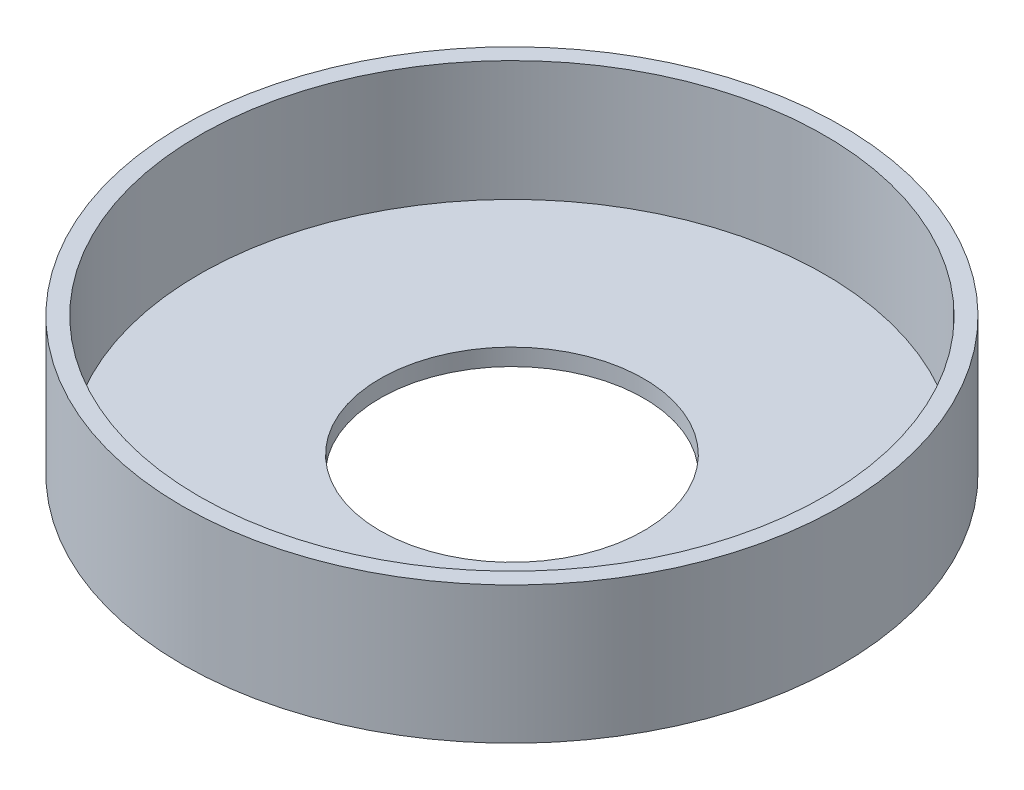
from build123d import *

# Parameters (mm, degrees)
SKETCH1_R           = 31.25
SKETCH1_R_2         = 12.5
BOSS_EXTRUDE1_DEPTH = 1.6
SKETCH2_R           = 31.25
SKETCH2_R_2         = 29.65
BOSS_EXTRUDE2_DEPTH = 11.4


with BuildPart() as part:
    # Sketch1 → Boss-Extrude1 (new body)
    with BuildSketch(Plane(origin=(0, 0, 0), x_dir=(1, 0, 0), z_dir=(0, 1, 0))):
        with Locations(Location((0, 0, 0), (0, 0, 270))):
            Circle(SKETCH1_R)
        with Locations(Location((0, 0, 0), (0, 0, 270))):
            Circle(SKETCH1_R_2, mode=Mode.SUBTRACT)
    extrude(amount=BOSS_EXTRUDE1_DEPTH)

    # Sketch2 → Boss-Extrude2 (add)
    with BuildSketch(Plane(origin=(0, 1.6, 0), x_dir=(1, 0, 0), z_dir=(0, 1, 0))):
        with Locations(Location((0, 0, 0), (0, 0, 270))):
            Circle(SKETCH2_R)
        with Locations(Location((0, 0, 0), (0, 0, 270))):
            Circle(SKETCH2_R_2, mode=Mode.SUBTRACT)
    extrude(amount=BOSS_EXTRUDE2_DEPTH)


solid = part.part
